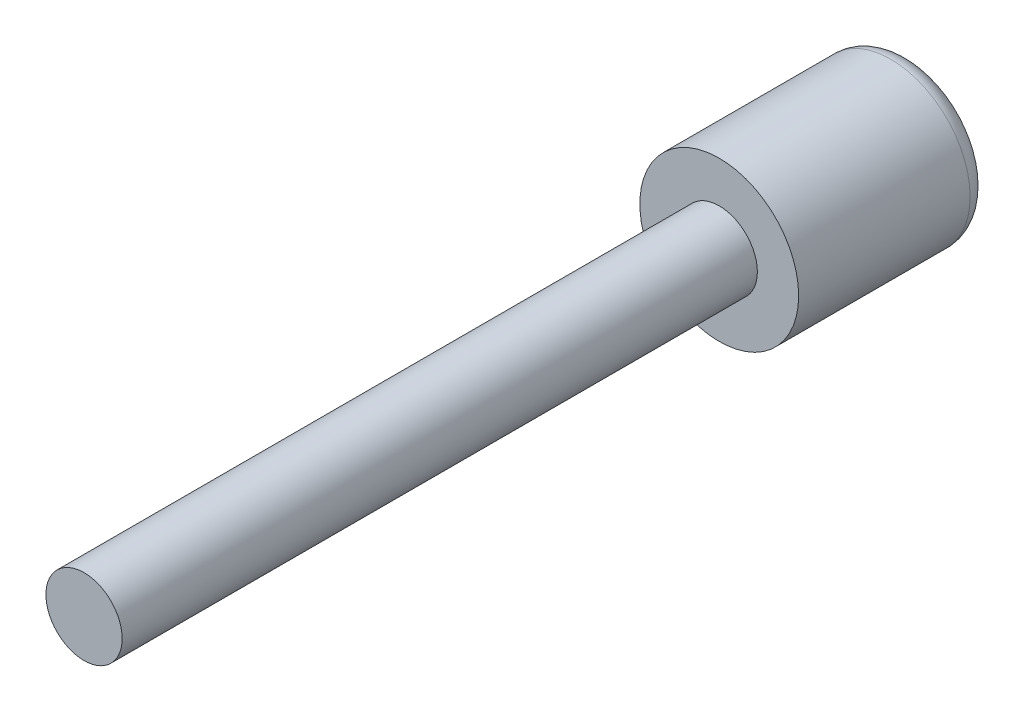
from build123d import *

# Parameters (mm, degrees)
SKETCH1_R           = 1.25
BOSS_EXTRUDE1_DEPTH = 3
SKETCH2_R           = 0.6
BOSS_EXTRUDE2_DEPTH = 10
FILLET2_R           = 0.3


with BuildPart() as part:
    # Sketch1 → Boss-Extrude1 (new body)
    with BuildSketch(Plane.XY):
        Circle(SKETCH1_R)
    extrude(amount=BOSS_EXTRUDE1_DEPTH)

    # Sketch2 → Boss-Extrude2 (add)
    with BuildSketch(Plane.XY.offset(3)):
        Circle(SKETCH2_R)
    extrude(amount=BOSS_EXTRUDE2_DEPTH)

    # Fillet2
    fillet2_edges = [part.edges().sort_by_distance(p)[0] for p in [
        (-1.25, 0, 0),
    ]]
    fillet(fillet2_edges, radius=FILLET2_R)


solid = part.part
